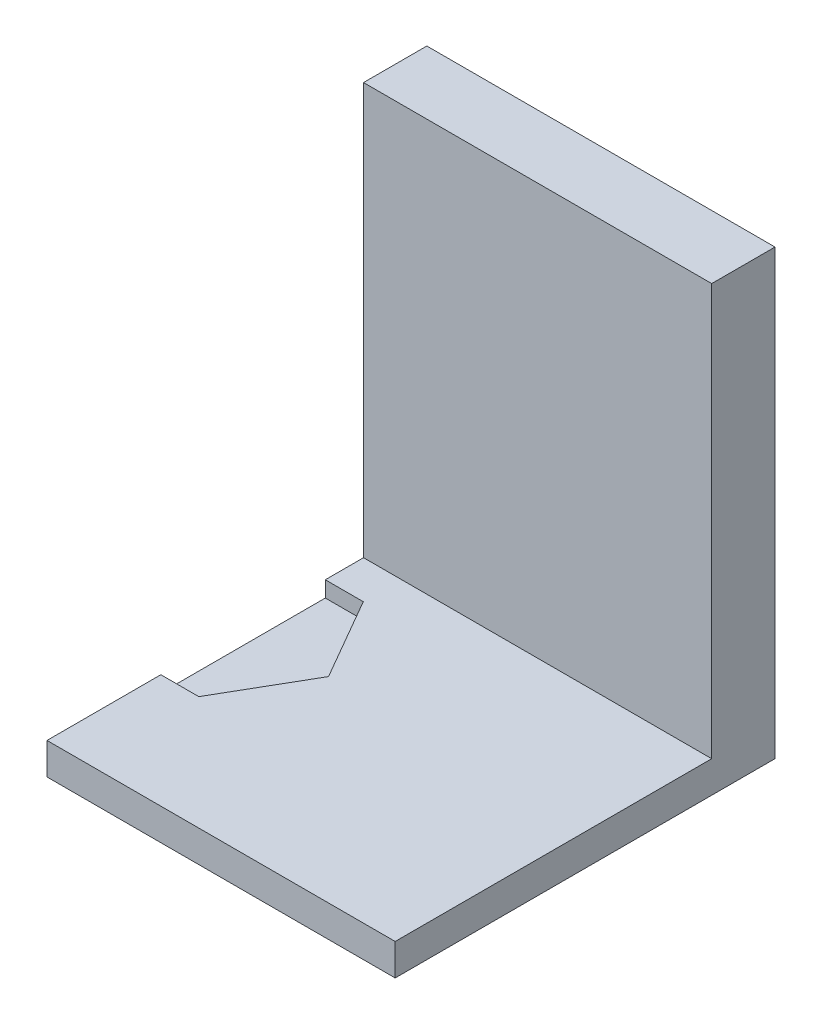
from build123d import *

# Parameters (mm, degrees)
SKETCH1_W                      = 670
SKETCH1_H                      = 120
BOSS_EXTRUDE1_DEPTH            = 530
SKETCH2_W                      = 100
SKETCH2_H                      = 200
SKETCH2_W_2                    = 650
SKETCH2_H_2                    = 250
CUT_EXTRUDE1_DEPTH             = 100
SKETCH3_R                      = 50
CUT_EXTRUDE2_DEPTH             = 260
F_12_0_12_DIAMETER_HOLE2_D     = 12
F_12_0_12_DIAMETER_HOLE2_DEPTH = 30
F_12_0_12_DIAMETER_HOLE2_TIP   = 3.605163714
SKETCH8_W                      = 650
SKETCH8_H                      = 50
BOSS_EXTRUDE2_DEPTH            = 5
SKETCH9_W                      = 10
SKETCH9_H                      = 250
CUT_EXTRUDE3_DEPTH             = 717
CUT_EXTRUDE4_DEPTH             = 5
SKETCH11_W                     = 10
SKETCH11_H                     = 100
BOSS_EXTRUDE3_DEPTH            = 78
BOSS_EXTRUDE3_2_DEPTH          = 78
BOSS_EXTRUDE3_3_DEPTH          = 78
SKETCH12_W                     = 20
SKETCH12_H                     = 30
CUT_EXTRUDE5_DEPTH             = 80
SKETCH15_W                     = 30
SKETCH15_H                     = 23.536156656
SKETCH15_H_2                   = 28.986603691
CUT_EXTRUDE7_DEPTH             = 35
SHELL1_T                       = -3
SKETCH16_W                     = 14
SKETCH16_H                     = 14
CUT_EXTRUDE8_DEPTH             = 35
SKETCH17_W                     = 5.729882812
SKETCH17_H                     = 17.428393554
SKETCH17_W_2                   = 13.369726562
SKETCH17_H_2                   = 3.342431641
BOSS_EXTRUDE4_DEPTH            = 5
CUT_EXTRUDE10_DEPTH            = 863.670273187
CUT_EXTRUDE10_DEPTH_BACK       = 863.670273187
SKETCH18_W                     = 670
SKETCH18_H                     = 250
CUT_EXTRUDE11_DEPTH            = 737.002717386
CUT_EXTRUDE11_DEPTH_BACK       = 737.002717386
SKETCH19_W                     = 222
SKETCH19_H                     = 280
SKETCH19_W_2                   = 338
CUT_EXTRUDE12_DEPTH            = 538.683922021
CUT_EXTRUDE12_DEPTH_BACK       = 538.683922021
SKETCH20_W                     = 110
SKETCH20_H                     = 140


with BuildPart() as part:
    # Sketch1 → Boss-Extrude1 (new body)
    with BuildSketch(Plane(origin=(0, 0, 0), x_dir=(1, 0, 0), z_dir=(0, 1, 0))):
        with Locations((335, 60)):
            Rectangle(SKETCH1_W, SKETCH1_H)
    extrude(amount=BOSS_EXTRUDE1_DEPTH)

    # Sketch2 → Cut-Extrude1 (cut)
    with BuildSketch(Plane.XY):
        with Locations((60, 380)):
            Rectangle(SKETCH2_W, SKETCH2_H)
        with Locations((170, 380)):
            Rectangle(SKETCH2_W, SKETCH2_H)
        with Locations((280, 380)):
            Rectangle(SKETCH2_W, SKETCH2_H)
        with Locations((390, 380)):
            Rectangle(SKETCH2_W, SKETCH2_H)
        with Locations((500, 380)):
            Rectangle(SKETCH2_W, SKETCH2_H)
        with Locations((610, 380)):
            Rectangle(SKETCH2_W, SKETCH2_H)
        with Locations((335, 135)):
            Rectangle(SKETCH2_W_2, SKETCH2_H_2)
    extrude(amount=-CUT_EXTRUDE1_DEPTH, mode=Mode.SUBTRACT)

    # Sketch3 → Cut-Extrude2 (cut)
    with BuildSketch(Plane(origin=(0, 530, 0), x_dir=(1, 0, 0), z_dir=(0, 1, 0))):
        with Locations((60, 60)):
            Circle(SKETCH3_R)
        with Locations((170, 60)):
            Circle(SKETCH3_R)
        with Locations((280, 60)):
            Circle(SKETCH3_R)
        with Locations((390, 60)):
            Circle(SKETCH3_R)
        with Locations((500, 60)):
            Circle(SKETCH3_R)
        with Locations((610, 60)):
            Circle(SKETCH3_R)
    extrude(amount=-CUT_EXTRUDE2_DEPTH, mode=Mode.SUBTRACT)

    # Ø12.0 (12) Diameter Hole2
    with Locations(Plane(origin=(59.704642413, 270, -102.411697903), x_dir=(0, 0, 1), z_dir=(0, 1, 0))):
        with Locations((0, 0), (-0.195888006, 111.8520513), (0.014838595, 221.167624818), (-0.341843303, 331.364008353), (0.657723149, 441.008646429), (1.288998006, 549.811854685)):
            Hole(F_12_0_12_DIAMETER_HOLE2_D / 2, depth=F_12_0_12_DIAMETER_HOLE2_DEPTH)
            with Locations((0, 0, -(F_12_0_12_DIAMETER_HOLE2_DEPTH + F_12_0_12_DIAMETER_HOLE2_TIP / 2))):  # 118° drill point
                Cone(0, F_12_0_12_DIAMETER_HOLE2_D / 2, F_12_0_12_DIAMETER_HOLE2_TIP, mode=Mode.SUBTRACT)

    # Sketch8 → Boss-Extrude2 (add)
    with BuildSketch(Plane.XY):
        with Locations((335, 305)):
            Rectangle(SKETCH8_W, SKETCH8_H)
    extrude(amount=-BOSS_EXTRUDE2_DEPTH)

    # Sketch9 → Cut-Extrude3 (cut)
    with BuildSketch(Plane(origin=(670, 0, 0), x_dir=(0, 0, -1), z_dir=(1, 0, 0))):
        with Locations((15, 135)):
            Rectangle(SKETCH9_W, SKETCH9_H)
    extrude(amount=-CUT_EXTRUDE3_DEPTH, mode=Mode.SUBTRACT)

    # Sketch10 → Cut-Extrude4 (cut)
    with BuildSketch(Plane(origin=(0, 10, 0), x_dir=(1, 0, 0), z_dir=(0, 1, 0))):
        Polygon((365, 61.943560596), (350, 87.924322709), (320, 87.924322709), (305, 61.943560596), (320, 35.962798482), (350, 35.962798482), align=None)
    extrude(amount=-CUT_EXTRUDE4_DEPTH, mode=Mode.SUBTRACT)

    # Sketch12 → Cut-Extrude5 (cut)
    with BuildSketch(Plane.XY.offset(-100)):
        with Locations((85.198613037, 245)):
            Rectangle(SKETCH12_W, SKETCH12_H)
        with Locations((195.198613037, 245)):
            Rectangle(SKETCH12_W, SKETCH12_H)
        with Locations((305.198613037, 245)):
            Rectangle(SKETCH12_W, SKETCH12_H)
        with Locations((415.198613037, 245)):
            Rectangle(SKETCH12_W, SKETCH12_H)
        with Locations((525.198613037, 245)):
            Rectangle(SKETCH12_W, SKETCH12_H)
        with Locations((635.198613037, 245)):
            Rectangle(SKETCH12_W, SKETCH12_H)
    extrude(amount=-CUT_EXTRUDE5_DEPTH, mode=Mode.SUBTRACT)

    # Sketch17 → Boss-Extrude4 (add)
    # profile 1 of 9: a face of its own
    with BuildSketch(Plane.XY):
        with BuildLine():
            Line((527.508830928, 289.835452458), (527.508830928, 307.263846012))
            Line((527.508830928, 307.263846012), (534.861434459, 307.263846012))
            add(Edge.make_bspline(
                [(534.861434459, 307.263846012), (535.181337774, 307.258256848), (535.803061116, 307.24739446), (536.703508491, 307.139069344), (537.544992916, 306.975202489), (538.325061607, 306.737496792), (539.040841948, 306.426020155), (539.698044515, 306.051894954), (540.290333057, 305.605079277), (540.822348212, 305.090232636), (541.284521701, 304.502523111), (541.692171296, 303.852565801), (542.030284458, 303.129762281), (542.309377095, 302.341316546), (542.5243908, 301.484161689), (542.679660381, 300.560045938), (542.773357357, 299.567500804), (542.783368073, 298.883107022), (542.788518428, 298.530997273)],
                knots=[0, 0, 0, 0, 1.135059408, 2.20595691, 3.214417064, 4.174978569, 5.094187092, 5.980001006, 6.853065862, 7.720814779, 8.600404634, 9.50058483, 10.438414914, 11.426825708, 12.465239141, 13.571113463, 14.750376389, 16, 16, 16, 16], degree=3))
            add(Edge.make_bspline(
                [(542.788518428, 298.530997273), (542.781740751, 298.180151665), (542.768592871, 297.499553336), (542.676885992, 296.511518461), (542.516733301, 295.591080531), (542.296748778, 294.736450427), (542.003051046, 293.953120444), (541.654236167, 293.233205539), (541.233025793, 292.585291498), (540.753136904, 292.000029304), (540.204772188, 291.484681411), (539.587651059, 291.044279297), (538.910779309, 290.668464036), (538.169670382, 290.361903209), (537.364073889, 290.124869172), (536.495133477, 289.954199984), (535.562644449, 289.853487388), (534.920131033, 289.841584621), (534.58911581, 289.835452458)],
                knots=[0, 0, 0, 0, 1.228418252, 2.382983832, 3.470276728, 4.496757894, 5.468023682, 6.394867725, 7.292157164, 8.167372942, 9.039072913, 9.918728341, 10.815246345, 11.744296628, 12.720973084, 13.750736166, 14.841206188, 16, 16, 16, 16], degree=3))
            Line((534.58911581, 289.835452458), (527.508830928, 289.835452458))
        make_face()
        with BuildLine():
            Line((533.238713741, 291.745413395), (534.048208904, 291.745413395))
            add(Edge.make_bspline(
                [(534.048208904, 291.745413395), (534.172894012, 291.749291978), (534.413033311, 291.756761998), (534.758676231, 291.825976613), (535.075745017, 291.938271137), (535.365749176, 292.094802589), (535.623404602, 292.300450923), (535.848862806, 292.551404902), (536.04776914, 292.844737637), (536.217685755, 293.190205032), (536.364284647, 293.596533622), (536.481764702, 294.076367921), (536.592118304, 294.630928744), (536.673672739, 295.265507643), (536.740044562, 295.978448886), (536.788346679, 296.768428292), (536.812018936, 297.636801208), (536.817188964, 298.241258393), (536.819890499, 298.55711002)],
                knots=[0, 0, 0, 0, 0.728710832, 1.403472396, 2.052289494, 2.690292559, 3.321919393, 3.970736491, 4.656696891, 5.388631723, 6.217040872, 7.17856157, 8.275589967, 9.523440737, 10.918935818, 12.463926104, 14.152268318, 16, 16, 16, 16], degree=3))
            add(Edge.make_bspline(
                [(536.819890499, 298.55711002), (536.8171426, 298.871715251), (536.811863063, 299.476166083), (536.7886758, 300.343334385), (536.739579947, 301.133216935), (536.674703848, 301.843934916), (536.589660404, 302.476324031), (536.488366458, 303.031681737), (536.362441588, 303.507627045), (536.222158727, 303.914921549), (536.050140993, 304.256514038), (535.858357073, 304.554097881), (535.62547107, 304.79746827), (535.36991257, 305.004888479), (535.079348843, 305.160875844), (534.761320266, 305.273944358), (534.414185903, 305.34216807), (534.172870641, 305.349893944), (534.048208904, 305.353885075)],
                knots=[0, 0, 0, 0, 1.842836665, 3.540640921, 5.080358154, 6.47765669, 7.719902824, 8.816971715, 9.781579111, 10.601733135, 11.334613876, 12.017393917, 12.666641099, 13.29908421, 13.937911793, 14.587567384, 15.270347425, 16, 16, 16, 16], degree=3))
            Line((534.048208904, 305.353885075), (533.238713741, 305.353885075))
            Line((533.238713741, 305.353885075), (533.238713741, 291.745413395))
        make_face(mode=Mode.SUBTRACT)
    # profile 2 of 9: a face of its own
    with BuildSketch(Plane.XY):
        with Locations((547.563420772, 298.549649235)):
            Rectangle(SKETCH17_W, SKETCH17_H)
    # profile 3 of 9: a face of its own
    with BuildSketch(Plane.XY):
        Polygon((564.514324092, 307.263846012), (564.514324092, 305.115139958), (558.545696163, 305.115139958), (558.545696163, 299.862747379), (563.559343624, 299.862747379), (563.559343624, 297.714041325), (558.545696163, 297.714041325), (558.545696163, 289.835452458), (552.81581335, 289.835452458), (552.81581335, 307.263846012), align=None)
    # profile 4 of 9: a face of its own
    with BuildSketch(Plane.XY):
        Polygon((577.645305538, 307.263846012), (577.645305538, 305.115139958), (571.676677608, 305.115139958), (571.676677608, 299.862747379), (576.690325069, 299.862747379), (576.690325069, 297.714041325), (571.676677608, 297.714041325), (571.676677608, 289.835452458), (565.946794795, 289.835452458), (565.946794795, 307.263846012), align=None)
    # profile 5 of 9: a face of its own
    with BuildSketch(Plane.XY):
        with Locations((584.330168819, 287.448001286)):
            Rectangle(SKETCH17_W_2, SKETCH17_H_2)
    # profile 6 of 9: a face of its own
    with BuildSketch(Plane.XY):
        with BuildLine():
            Line((605.578484249, 307.263846012), (605.578484249, 295.602639195))
            add(Edge.make_bspline(
                [(605.578484249, 295.602639195), (605.574209777, 295.35989389), (605.565919345, 294.889083964), (605.480877158, 294.20653885), (605.349958188, 293.569747554), (605.15926554, 292.978838165), (604.911867049, 292.436847071), (604.616163877, 291.936663973), (604.260702644, 291.487723021), (603.847299908, 291.08966617), (603.386881991, 290.731670113), (602.867295001, 290.425440037), (602.293741958, 290.168488385), (601.66690529, 289.960990771), (600.988052682, 289.797299786), (600.254912883, 289.679078851), (599.467035781, 289.60781007), (598.923618241, 289.60048219), (598.643684673, 289.59670734)],
                knots=[0, 0, 0, 0, 1.108173197, 2.149326602, 3.136215123, 4.073726706, 4.978516626, 5.852185058, 6.72141202, 7.584905625, 8.467554395, 9.379216169, 10.332422268, 11.332766067, 12.390653242, 13.518530507, 14.721707419, 16, 16, 16, 16], degree=3))
            add(Edge.make_bspline(
                [(598.643684673, 289.59670734), (598.373688491, 289.600411437), (597.851346557, 289.607577482), (597.093280473, 289.679448684), (596.387523889, 289.797736542), (595.733050135, 289.960122315), (595.130189942, 290.169220301), (594.579048171, 290.42623041), (594.078350789, 290.732835498), (593.633858028, 291.090104794), (593.234289459, 291.486851767), (592.899913678, 291.940746827), (592.609043638, 292.435866034), (592.375223767, 292.980322997), (592.191754821, 293.570441519), (592.063541006, 294.20666921), (591.983676196, 294.889343196), (591.974661767, 295.359932437), (591.970012569, 295.602639195)],
                knots=[0, 0, 0, 0, 1.258901956, 2.435505865, 3.547148904, 4.59359074, 5.576649289, 6.5183682, 7.424469602, 8.307507093, 9.172751023, 10.042627298, 10.928839176, 11.845659241, 12.799442865, 13.80597989, 14.868432463, 16, 16, 16, 16], degree=3))
            Line((591.970012569, 295.602639195), (591.970012569, 307.263846012))
            Line((591.970012569, 307.263846012), (597.699895381, 307.263846012))
            Line((597.699895381, 307.263846012), (597.699895381, 295.457153889))
            add(Edge.make_bspline(
                [(597.699895381, 295.457153889), (597.700816195, 295.287996189), (597.702584578, 294.963135903), (597.729908723, 294.499051493), (597.768241004, 294.079064133), (597.828226169, 293.705517832), (597.90066041, 293.377063412), (597.989882091, 293.09281535), (598.094998068, 292.852496478), (598.225239063, 292.654232043), (598.380826623, 292.495135011), (598.55368342, 292.353231761), (598.757556996, 292.238543846), (598.987648905, 292.146224908), (599.243380948, 292.070549638), (599.526120553, 292.020376099), (599.83553351, 291.990763905), (600.049971942, 291.986424568), (600.161954402, 291.984158512)],
                knots=[0, 0, 0, 0, 1.622370975, 3.115695595, 4.458049099, 5.666011203, 6.742434742, 7.681714947, 8.519814998, 9.250928664, 9.942747364, 10.646898194, 11.389596108, 12.175933929, 13.021386247, 13.943159715, 14.925891993, 16, 16, 16, 16], degree=3))
            add(Edge.make_bspline(
                [(600.161954402, 291.984158512), (600.283927219, 291.987190593), (600.521124756, 291.993087005), (600.86597014, 292.03390861), (601.187714881, 292.103380086), (601.484890424, 292.205377303), (601.758665297, 292.332852529), (602.012761516, 292.484567923), (602.236391413, 292.674631152), (602.439076761, 292.888441291), (602.620738276, 293.128529789), (602.771757722, 293.399928575), (602.905501548, 293.697121508), (603.005823683, 294.025060118), (603.089837826, 294.379999499), (603.146989706, 294.763086929), (603.186210275, 295.174074524), (603.189394751, 295.457053988), (603.191033077, 295.602639195)],
                knots=[0, 0, 0, 0, 1.083870311, 2.107775948, 3.08105344, 4.003637981, 4.893545291, 5.761570557, 6.624657808, 7.49233129, 8.376387281, 9.291996285, 10.246843261, 11.267344133, 12.334180325, 13.486053461, 14.706643157, 16, 16, 16, 16], degree=3))
            Line((603.191033077, 295.602639195), (603.191033077, 307.263846012))
            Line((603.191033077, 307.263846012), (605.578484249, 307.263846012))
        make_face()
    # profile 7 of 9: a face of its own
    with BuildSketch(Plane.XY):
        with BuildLine():
            Line((619.731593227, 302.015183827), (616.739818477, 301.526502415))
            add(Edge.make_bspline(
                [(616.739818477, 301.526502415), (616.748849224, 301.670726223), (616.765660669, 301.939210177), (616.78429066, 302.312269209), (616.796668381, 302.625642376), (616.798628236, 302.814722915), (616.799504756, 302.899286839)],
                knots=[0, 0, 0, 0, 1.261802504, 2.348944521, 3.261585937, 4, 4, 4, 4], degree=3))
            add(Edge.make_bspline(
                [(616.799504756, 302.899286839), (616.798306068, 303.007660677), (616.795968139, 303.219033721), (616.750451916, 303.523894877), (616.694806916, 303.811547356), (616.604352699, 304.076787391), (616.488181329, 304.320314265), (616.348943917, 304.543955606), (616.184187178, 304.745078709), (615.995833421, 304.928129987), (615.778009957, 305.083200131), (615.536269472, 305.218702836), (615.269765326, 305.333844758), (614.978065514, 305.431346685), (614.660683072, 305.504624438), (614.319025281, 305.556776695), (613.952471696, 305.585673441), (613.699597795, 305.590260771), (613.568984889, 305.592630192)],
                knots=[0, 0, 0, 0, 1.079280541, 2.105035848, 3.067950317, 3.99715044, 4.889989748, 5.753421302, 6.617030865, 7.476358039, 8.364190572, 9.274590025, 10.235106994, 11.254473582, 12.337095886, 13.478601727, 14.697662529, 16, 16, 16, 16], degree=3))
            add(Edge.make_bspline(
                [(613.568984889, 305.592630192), (613.391954632, 305.58912286), (613.059112606, 305.582528579), (612.595688488, 305.495339748), (612.198743126, 305.361419257), (611.87165349, 305.163811893), (611.613188167, 304.909795747), (611.433841092, 304.593316589), (611.323009072, 304.224665915), (611.313400221, 303.959558324), (611.308367061, 303.820693775)],
                knots=[0, 0, 0, 0, 1.294917039, 2.43462794, 3.440028966, 4.347597256, 5.210608309, 6.06356377, 6.985685997, 8, 8, 8, 8], degree=3))
            add(Edge.make_bspline(
                [(611.308367061, 303.820693775), (611.317562032, 303.705133219), (611.336106628, 303.472068433), (611.47315858, 303.132808312), (611.695999602, 302.811560885), (612.009295906, 302.510664216), (612.404107796, 302.221967273), (612.884407504, 301.948533431), (613.450813789, 301.688189695), (613.862519081, 301.536023727), (614.080048656, 301.455624958)],
                knots=[0, 0, 0, 0, 0.716839541, 1.445735977, 2.240793036, 3.131329288, 4.131129903, 5.273471266, 6.559404876, 8, 8, 8, 8], degree=3))
            add(Edge.make_bspline(
                [(614.080048656, 301.455624958), (614.335934702, 301.364918412), (614.834564244, 301.188164095), (615.547657928, 300.88707802), (616.213068388, 300.5749594), (616.829579094, 300.246613346), (617.397833174, 299.90520698), (617.914851624, 299.544556457), (618.386199073, 299.173962102), (618.807001026, 298.783874588), (619.177995113, 298.378100064), (619.4958685, 297.952745357), (619.771807525, 297.51723103), (619.991113975, 297.061458502), (620.169645242, 296.594624218), (620.292698657, 296.11024444), (620.364288243, 295.609761088), (620.37516617, 295.270864226), (620.380681514, 295.099036213)],
                knots=[0, 0, 0, 0, 1.359488612, 2.649152603, 3.874964776, 5.039588756, 6.146130126, 7.193090393, 8.194917302, 9.146793662, 10.063845301, 10.944476293, 11.803344532, 12.641736646, 13.473440096, 14.302714936, 15.139439897, 16, 16, 16, 16], degree=3))
            add(Edge.make_bspline(
                [(620.380681514, 295.099036213), (620.374476075, 294.902306495), (620.362285176, 294.515820995), (620.280160209, 293.948630617), (620.138011896, 293.409496554), (619.938489338, 292.895972278), (619.681049879, 292.411946655), (619.366518754, 291.954381076), (618.996510229, 291.525099427), (618.5710008, 291.128381035), (618.102222518, 290.765302239), (617.587803957, 290.450854345), (617.034458515, 290.187092261), (616.444107988, 289.968993032), (615.81453624, 289.801373099), (615.145337453, 289.685291013), (614.438790193, 289.606619894), (613.954683001, 289.600062276), (613.70700941, 289.59670734)],
                knots=[0, 0, 0, 0, 0.972121714, 1.909782367, 2.824924061, 3.721832975, 4.62620438, 5.527836938, 6.46026819, 7.421000932, 8.398101015, 9.385579713, 10.394244048, 11.422703992, 12.491421888, 13.608778581, 14.776629625, 16, 16, 16, 16], degree=3))
            add(Edge.make_bspline(
                [(613.70700941, 289.59670734), (613.445745367, 289.599650312), (612.939893069, 289.605348413), (612.207608113, 289.66709241), (611.525297432, 289.760984454), (610.893395078, 289.899706116), (610.309273131, 290.072394336), (609.776099392, 290.288320955), (609.295310255, 290.547303481), (608.863217672, 290.843007892), (608.478306623, 291.175775461), (608.148120946, 291.551766865), (607.86942369, 291.967163224), (607.639947144, 292.421521488), (607.466477665, 292.917583541), (607.339164663, 293.449829748), (607.264537999, 294.021332449), (607.254747521, 294.414908557), (607.249700069, 294.617815586)],
                knots=[0, 0, 0, 0, 1.342201143, 2.598733168, 3.773451092, 4.878874364, 5.91991243, 6.900006476, 7.829142054, 8.72062616, 9.585588575, 10.436728592, 11.283829734, 12.149664931, 13.044964919, 13.977937424, 14.957531465, 16, 16, 16, 16], degree=3))
            add(Edge.make_bspline(
                [(607.249700069, 294.617815586), (607.250803815, 294.692425759), (607.253213998, 294.855347393), (607.260452266, 295.122772538), (607.275636683, 295.433682216), (607.29037174, 295.656130545), (607.298195171, 295.774237248)],
                knots=[0, 0, 0, 0, 0.773500207, 1.689044709, 2.77302154, 4, 4, 4, 4], degree=3))
            Line((607.298195171, 295.774237248), (610.36457777, 296.337526509))
            add(Edge.make_bspline(
                [(610.36457777, 296.337526509), (610.326952988, 296.136337493), (610.255606535, 295.754830366), (610.178678473, 295.21219969), (610.124206629, 294.733311493), (610.11767002, 294.435147371), (610.114641475, 294.297001835)],
                knots=[0, 0, 0, 0, 1.192988372, 2.262218769, 3.194850416, 4, 4, 4, 4], degree=3))
            add(Edge.make_bspline(
                [(610.114641475, 294.297001835), (610.116191817, 294.183708768), (610.119182568, 293.965156219), (610.159053378, 293.648552813), (610.215988606, 293.352999663), (610.302906772, 293.079707227), (610.411206928, 292.826307836), (610.544682453, 292.59538211), (610.704385489, 292.386485019), (610.887496571, 292.200099922), (611.094689168, 292.033628705), (611.327456494, 291.892756696), (611.58347653, 291.771733922), (611.864681562, 291.677479524), (612.167961721, 291.596080628), (612.497219749, 291.548235723), (612.849461228, 291.512043782), (613.092629543, 291.508500084), (613.218327999, 291.506668278)],
                knots=[0, 0, 0, 0, 1.135776692, 2.191015738, 3.19649269, 4.151244236, 5.061952528, 5.956281389, 6.819534407, 7.692823504, 8.571441916, 9.478554956, 10.416037156, 11.406231466, 12.450054172, 13.561596327, 14.739541482, 16, 16, 16, 16], degree=3))
            add(Edge.make_bspline(
                [(613.218327999, 291.506668278), (613.423996012, 291.510791273), (613.810619321, 291.518541853), (614.349272542, 291.616708407), (614.810575885, 291.768742445), (615.189785268, 291.991387532), (615.490778961, 292.278756613), (615.698005174, 292.637320004), (615.824813318, 293.05638326), (615.837728413, 293.355975238), (615.844524288, 293.513619419)],
                knots=[0, 0, 0, 0, 1.308765556, 2.460272085, 3.475015317, 4.388076298, 5.239673503, 6.095681635, 6.997954785, 8, 8, 8, 8], degree=3))
            add(Edge.make_bspline(
                [(615.844524288, 293.513619419), (615.833808824, 293.638242951), (615.811807312, 293.894126055), (615.644884004, 294.264515838), (615.382382362, 294.620631473), (615.016807277, 294.962984909), (614.551376589, 295.293471235), (613.986957743, 295.616730224), (613.322148235, 295.933112033), (612.83677959, 296.119639164), (612.580430889, 296.21815395)],
                knots=[0, 0, 0, 0, 0.667930748, 1.371427933, 2.146459016, 3.034714139, 4.04893387, 5.207327294, 6.525042705, 8, 8, 8, 8], degree=3))
            add(Edge.make_bspline(
                [(612.580430889, 296.21815395), (612.374354345, 296.29679374), (611.970646869, 296.450850434), (611.394079385, 296.713586304), (610.853066711, 296.987016804), (610.357486361, 297.288235735), (609.896382561, 297.599610528), (609.477036946, 297.932256792), (609.09841673, 298.284556341), (608.758710772, 298.653375077), (608.457302107, 299.038989264), (608.199448649, 299.444659231), (607.977533299, 299.866789834), (607.798609588, 300.308107488), (607.65975715, 300.767821241), (607.559616231, 301.244439392), (607.497905054, 301.739995674), (607.491630423, 302.075933546), (607.488445186, 302.246468159)],
                knots=[0, 0, 0, 0, 1.249558333, 2.447906163, 3.58867143, 4.682264114, 5.731748367, 6.739728761, 7.711906036, 8.659384707, 9.578321416, 10.481344598, 11.379544271, 12.277135726, 13.175418307, 14.097160112, 15.034047388, 16, 16, 16, 16], degree=3))
            add(Edge.make_bspline(
                [(607.488445186, 302.246468159), (607.49282555, 302.439538736), (607.501402184, 302.817565692), (607.587451154, 303.36980586), (607.719291893, 303.894921371), (607.910558542, 304.389343064), (608.156192894, 304.852853762), (608.453187669, 305.288766511), (608.804241719, 305.697593471), (609.213503754, 306.066686531), (609.657214714, 306.407618241), (610.14376173, 306.697651931), (610.658716537, 306.950861947), (611.210636666, 307.148827868), (611.791820619, 307.313252612), (612.408080529, 307.421140415), (613.056315391, 307.490701612), (613.499160755, 307.498567824), (613.725661373, 307.502591129)],
                knots=[0, 0, 0, 0, 1.01033566, 1.978209831, 2.919499157, 3.840961976, 4.746855014, 5.660740114, 6.597989116, 7.56120833, 8.541877795, 9.523498025, 10.522416858, 11.542172371, 12.589598349, 13.681636521, 14.814234488, 16, 16, 16, 16], degree=3))
            add(Edge.make_bspline(
                [(613.725661373, 307.502591129), (613.968269855, 307.498219033), (614.438190994, 307.489750488), (615.120391152, 307.426787419), (615.755073228, 307.319142339), (616.345153155, 307.171557286), (616.887304575, 306.977590666), (617.384933999, 306.742393454), (617.834452216, 306.46201507), (618.236961315, 306.139451502), (618.593086714, 305.773322851), (618.897467704, 305.361641069), (619.158701245, 304.909408454), (619.366684143, 304.412232174), (619.529870326, 303.873247147), (619.649133834, 303.29158184), (619.720420497, 302.667301443), (619.72779778, 302.236712324), (619.731593227, 302.015183827)],
                knots=[0, 0, 0, 0, 1.248314423, 2.417925914, 3.521398822, 4.558068205, 5.543720209, 6.479599284, 7.385061127, 8.263440163, 9.127722873, 10.00561236, 10.891325273, 11.808802823, 12.772251995, 13.784947978, 14.860405143, 16, 16, 16, 16], degree=3))
        make_face()
    # profile 8 of 9: a face of its own
    with BuildSketch(Plane.XY):
        Polygon((633.989153194, 307.263846012), (633.989153194, 305.115139958), (628.020525264, 305.115139958), (628.020525264, 300.340237614), (633.034172725, 300.340237614), (633.034172725, 298.191531559), (628.020525264, 298.191531559), (628.020525264, 291.984158512), (634.944133663, 291.984158512), (634.944133663, 289.835452458), (622.290642452, 289.835452458), (622.290642452, 307.263846012), align=None)
    # profile 9 of 9: a face of its own
    with BuildSketch(Plane.XY):
        with BuildLine():
            Line((636.376604366, 289.835452458), (636.376604366, 307.263846012))
            Line((636.376604366, 307.263846012), (643.990335369, 307.263846012))
            add(Edge.make_bspline(
                [(643.990335369, 307.263846012), (644.237946498, 307.261150834), (644.721600887, 307.25588639), (645.426490561, 307.189203683), (646.094808274, 307.090496236), (646.724915796, 306.949857504), (647.317873659, 306.767252686), (647.871119087, 306.542146), (648.390701058, 306.282329135), (648.864494846, 305.976472528), (649.295093616, 305.642889252), (649.669668547, 305.279483604), (649.990389523, 304.894749072), (650.250664962, 304.483256345), (650.454275633, 304.048690948), (650.59581384, 303.587791605), (650.684089268, 303.104102537), (650.695510601, 302.772834174), (650.701311397, 302.604585835)],
                knots=[0, 0, 0, 0, 1.303269877, 2.545653735, 3.724355284, 4.8584284, 5.941462088, 6.987020715, 8.000098032, 8.995332524, 9.951400474, 10.863507538, 11.737823931, 12.582415999, 13.420128714, 14.25671499, 15.114600608, 16, 16, 16, 16], degree=3))
            add(Edge.make_bspline(
                [(650.701311397, 302.604585835), (650.698282873, 302.472674957), (650.692382063, 302.215658276), (650.651041486, 301.838684287), (650.580643818, 301.480313933), (650.481036683, 301.139915259), (650.347814833, 300.820175594), (650.191279492, 300.517863507), (650.009772227, 300.230553342), (649.788675198, 299.970497982), (649.548268341, 299.722842359), (649.274558803, 299.497116911), (648.974487035, 299.288655528), (648.642526299, 299.104010513), (648.287619671, 298.928055749), (647.899038177, 298.784921972), (647.486819978, 298.644749395), (647.19793098, 298.577036306), (647.049257183, 298.54218845)],
                knots=[0, 0, 0, 0, 1.057156483, 2.059775939, 3.035078039, 3.981068617, 4.897189472, 5.80650904, 6.70770952, 7.613691521, 8.536886357, 9.470937334, 10.45233069, 11.461024139, 12.51295332, 13.623444893, 14.776929983, 16, 16, 16, 16], degree=3))
            add(Edge.make_bspline(
                [(647.049257183, 298.54218845), (647.19164695, 298.499279419), (647.467865022, 298.416041346), (647.856360945, 298.265600017), (648.211652989, 298.111536308), (648.524185739, 297.936781388), (648.807636894, 297.762122504), (649.047122259, 297.564301324), (649.255235567, 297.361673563), (649.425188343, 297.135464734), (649.570253643, 296.882344437), (649.694827156, 296.586596707), (649.815179167, 296.247423665), (649.917667348, 295.859098311), (650.004750555, 295.423699276), (650.088222437, 294.944027189), (650.153853601, 294.416024546), (650.187587341, 294.048412906), (650.2051692, 293.856815525)],
                knots=[0, 0, 0, 0, 1.149282524, 2.229462177, 3.219229774, 4.139917433, 4.995948464, 5.788695735, 6.536448429, 7.236319808, 7.968460079, 8.78645307, 9.713791991, 10.749194692, 11.887975363, 13.146018663, 14.512518948, 16, 16, 16, 16], degree=3))
            add(Edge.make_bspline(
                [(650.2051692, 293.856815525), (650.225980287, 293.627849833), (650.265975604, 293.187817268), (650.348933081, 292.554613589), (650.44386163, 291.974357025), (650.555874504, 291.44528724), (650.681301216, 290.967898855), (650.821280597, 290.540469593), (650.979920039, 290.165788217), (651.10484481, 289.941461656), (651.163880062, 289.835452458)],
                knots=[0, 0, 0, 0, 1.324580516, 2.545615266, 3.678710841, 4.711533017, 5.660403917, 6.521349952, 7.301239649, 8, 8, 8, 8], degree=3))
            Line((651.163880062, 289.835452458), (645.213904094, 289.835452458))
            add(Edge.make_bspline(
                [(645.213904094, 289.835452458), (645.12229736, 290.069847279), (644.935171241, 290.548648246), (644.7595281, 291.319414791), (644.64846922, 292.142514735), (644.635117598, 292.70994511), (644.628232479, 293.002555653)],
                knots=[0, 0, 0, 0, 0.930410518, 1.900560147, 2.917368081, 4, 4, 4, 4], degree=3))
            Line((644.628232479, 293.002555653), (644.605850124, 294.002300831))
            Line((644.605850124, 294.002300831), (644.579737377, 295.266903874))
            add(Edge.make_bspline(
                [(644.579737377, 295.266903874), (644.573694669, 295.477395004), (644.562357007, 295.872330118), (644.469348432, 296.426164013), (644.30178735, 296.894645884), (644.073222546, 297.287223005), (643.766741442, 297.590613479), (643.39104803, 297.804152917), (642.950456912, 297.93396284), (642.634664848, 297.946292392), (642.468335247, 297.952786442)],
                knots=[0, 0, 0, 0, 1.295300309, 2.430314163, 3.439929415, 4.342995669, 5.203512789, 6.060756153, 6.978588463, 8, 8, 8, 8], degree=3))
            Line((642.468335247, 297.952786442), (642.106487178, 297.952786442))
            Line((642.106487178, 297.952786442), (642.106487178, 289.835452458))
            Line((642.106487178, 289.835452458), (636.376604366, 289.835452458))
        make_face()
        with BuildLine():
            Line((642.106487178, 299.862747379), (642.617550945, 299.862747379))
            add(Edge.make_bspline(
                [(642.617550945, 299.862747379), (642.722054451, 299.865172716), (642.925280724, 299.869889229), (643.220054897, 299.898289891), (643.494111408, 299.951809873), (643.749840966, 300.021017819), (643.984372137, 300.114851792), (644.200147241, 300.225818296), (644.391160406, 300.362685327), (644.565327067, 300.516342321), (644.718148635, 300.691986294), (644.850351299, 300.889034217), (644.961199162, 301.106225057), (645.056078491, 301.342818683), (645.125883912, 301.600830857), (645.173262731, 301.879472914), (645.203404658, 302.177423605), (645.207875435, 302.383174491), (645.210173702, 302.488943669)],
                knots=[0, 0, 0, 0, 1.184986479, 2.304423995, 3.352332712, 4.347714965, 5.303263624, 6.211353909, 7.091434645, 7.960150225, 8.839440182, 9.723126897, 10.64371617, 11.599264829, 12.608232147, 13.667459739, 14.800924404, 16, 16, 16, 16], degree=3))
            add(Edge.make_bspline(
                [(645.210173702, 302.488943669), (645.207875435, 302.594712847), (645.203404658, 302.800463732), (645.173262731, 303.098414423), (645.125883912, 303.37705648), (645.056078491, 303.635068654), (644.961199162, 303.87166228), (644.850351299, 304.08885312), (644.718148635, 304.285901043), (644.565327067, 304.461545017), (644.391160406, 304.61520201), (644.200147241, 304.752069041), (643.984372137, 304.863035546), (643.749840966, 304.956869518), (643.494111408, 305.026077464), (643.220054897, 305.079597446), (642.925280724, 305.107998108), (642.722054451, 305.112714621), (642.617550945, 305.115139958)],
                knots=[0, 0, 0, 0, 1.199075596, 2.332540261, 3.391767853, 4.400735171, 5.35628383, 6.276873103, 7.160559818, 8.039849775, 8.908565355, 9.788646091, 10.696736376, 11.652285035, 12.647667288, 13.695576005, 14.815013521, 16, 16, 16, 16], degree=3))
            Line((642.617550945, 305.115139958), (642.106487178, 305.115139958))
            Line((642.106487178, 305.115139958), (642.106487178, 299.862747379))
        make_face(mode=Mode.SUBTRACT)
    extrude(amount=BOSS_EXTRUDE4_DEPTH)

    # Sketch18 → Cut-Extrude10 (cut, two sides: drawn at the far end of the back side and taken through both)
    with BuildSketch(Plane.XY.offset(-CUT_EXTRUDE10_DEPTH_BACK)):
        with Locations((335, 405)):
            Rectangle(SKETCH18_W, SKETCH18_H)
    extrude(amount=CUT_EXTRUDE10_DEPTH + CUT_EXTRUDE10_DEPTH_BACK, mode=Mode.SUBTRACT)

    # Sketch19 → Cut-Extrude11 (cut, two sides: drawn at the far end of the back side and taken through both)
    with BuildSketch(Plane(origin=(0, 0, -120), x_dir=(-1, 0, 0), z_dir=(0, 0, -1)).offset(-CUT_EXTRUDE11_DEPTH_BACK)):
        with Locations((-559, 140)):
            Rectangle(SKETCH19_W, SKETCH19_H)
        with Locations((-169, 140)):
            Rectangle(SKETCH19_W_2, SKETCH19_H)
    extrude(amount=CUT_EXTRUDE11_DEPTH + CUT_EXTRUDE11_DEPTH_BACK, mode=Mode.SUBTRACT)

    # Sketch20 → Cut-Extrude12 (cut, two sides: drawn at the far end of the back side and taken through both)
    with BuildSketch(Plane.XY.offset(-100).offset(-CUT_EXTRUDE12_DEPTH_BACK)):
        with Locations((393, 210)):
            Rectangle(SKETCH20_W, SKETCH20_H)
    extrude(amount=CUT_EXTRUDE12_DEPTH + CUT_EXTRUDE12_DEPTH_BACK, mode=Mode.SUBTRACT)


with BuildPart() as body_2:
    # Sketch11 → Boss-Extrude3 (new body)
    with BuildSketch(Plane.XY.offset(-100)):
        with Locations((255, 60)):
            Rectangle(SKETCH11_W, SKETCH11_H)
    extrude(amount=BOSS_EXTRUDE3_DEPTH)


with BuildPart() as body_3:
    # Sketch11 → Boss-Extrude3 2 (new body)
    with BuildSketch(Plane.XY.offset(-100)):
        with Locations((415, 60)):
            Rectangle(SKETCH11_W, SKETCH11_H)
    extrude(amount=BOSS_EXTRUDE3_2_DEPTH)


with BuildPart() as body_4:
    # Sketch11 → Boss-Extrude3 3 (new body)
    with BuildSketch(Plane.XY.offset(-100)):
        Polygon((25, 198.45686471), (325, 145.558770497), (325, 122.01775856), (345, 122.01775856), (345, 145.558770497), (645, 198.45686471), align=None)
    extrude(amount=BOSS_EXTRUDE3_3_DEPTH)

    # Sketch15 → Cut-Extrude7 (cut)
    with BuildSketch(Plane(origin=(345, 0, 0), x_dir=(0, 0, -1), z_dir=(1, 0, 0))):
        with Locations((35, 133.231921672)):
            Rectangle(SKETCH15_W, SKETCH15_H)
        with Locations((85, 130.506698154)):
            Rectangle(SKETCH15_W, SKETCH15_H_2)
    extrude(amount=-CUT_EXTRUDE7_DEPTH, mode=Mode.SUBTRACT)

    # Shell1
    shell1_openings = [body_4.faces().sort_by_distance(p)[0] for p in [
        (335, 198.45686471, -61),
    ]]
    offset(amount=SHELL1_T, openings=shell1_openings, kind=Kind.INTERSECTION)

    # Sketch16 → Cut-Extrude8 (cut)
    with BuildSketch(Plane.XZ.offset(-122.01775856)):
        with Locations((335, -60)):
            Rectangle(SKETCH16_W, SKETCH16_H)
    extrude(amount=-CUT_EXTRUDE8_DEPTH, mode=Mode.SUBTRACT)


solid = part.part
